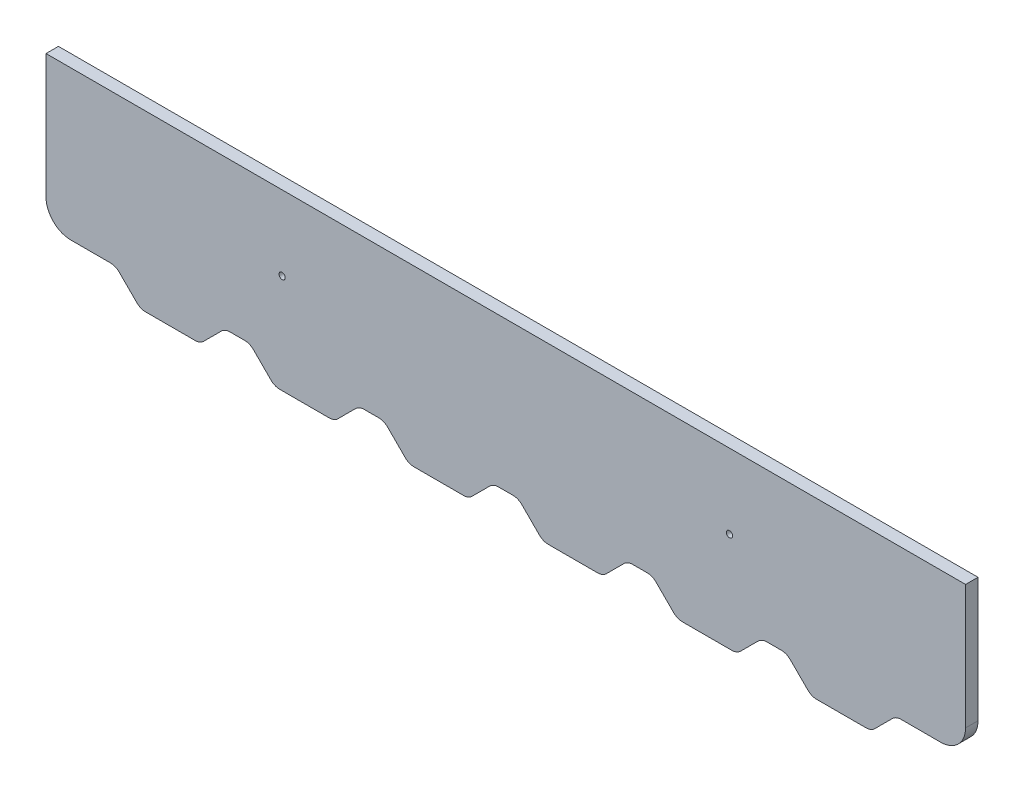
from build123d import *

# Parameters (mm, degrees)
SKETCH1_R           = 1.25
BOSS_EXTRUDE1_DEPTH = 5
FILLET1_R           = 5
FILLET2_R           = 10


with BuildPart() as part:
    # Sketch1 → Boss-Extrude1 (new body)
    with BuildSketch(Plane.XY):
        Polygon((-185, -30), (-157, -30), (-147, -40), (-123, -40), (-113, -30), (-103, -30), (-93, -40), (-69, -40), (-59, -30), (-49, -30), (-39, -40), (-15, -40), (-5, -30), (5, -30), (15, -40), (39, -40), (49, -30), (59, -30), (69, -40), (93, -40), (103, -30), (113, -30), (123, -40), (147, -40), (157, -30), (185, -30), (185, 30), (-185, 30), align=None)
        with Locations((-90, 0)):
            Circle(SKETCH1_R, mode=Mode.SUBTRACT)
        with Locations(Location((90, 0, 0), (0, 0, 180))):
            Circle(SKETCH1_R, mode=Mode.SUBTRACT)
    extrude(amount=BOSS_EXTRUDE1_DEPTH)

    # Fillet1
    fillet1_edges = [part.edges().sort_by_distance(p)[0] for p in [
        (157, -30, 2.5),
        (147, -40, 2.5),
        (123, -40, 2.5),
        (113, -30, 2.5),
        (103, -30, 2.5),
        (93, -40, 2.5),
        (69, -40, 2.5),
        (59, -30, 2.5),
        (49, -30, 2.5),
        (39, -40, 2.5),
        (15, -40, 2.5),
        (5, -30, 2.5),
        (-5, -30, 2.5),
        (-15, -40, 2.5),
        (-39, -40, 2.5),
        (-49, -30, 2.5),
        (-59, -30, 2.5),
        (-69, -40, 2.5),
        (-93, -40, 2.5),
        (-103, -30, 2.5),
        (-113, -30, 2.5),
        (-123, -40, 2.5),
        (-147, -40, 2.5),
        (-157, -30, 2.5),
    ]]
    fillet(fillet1_edges, radius=FILLET1_R)

    # Fillet2
    fillet2_edges = [part.edges().sort_by_distance(p)[0] for p in [
        (185, -30, 2.5),
        (-185, -30, 2.5),
    ]]
    fillet(fillet2_edges, radius=FILLET2_R)


solid = part.part
